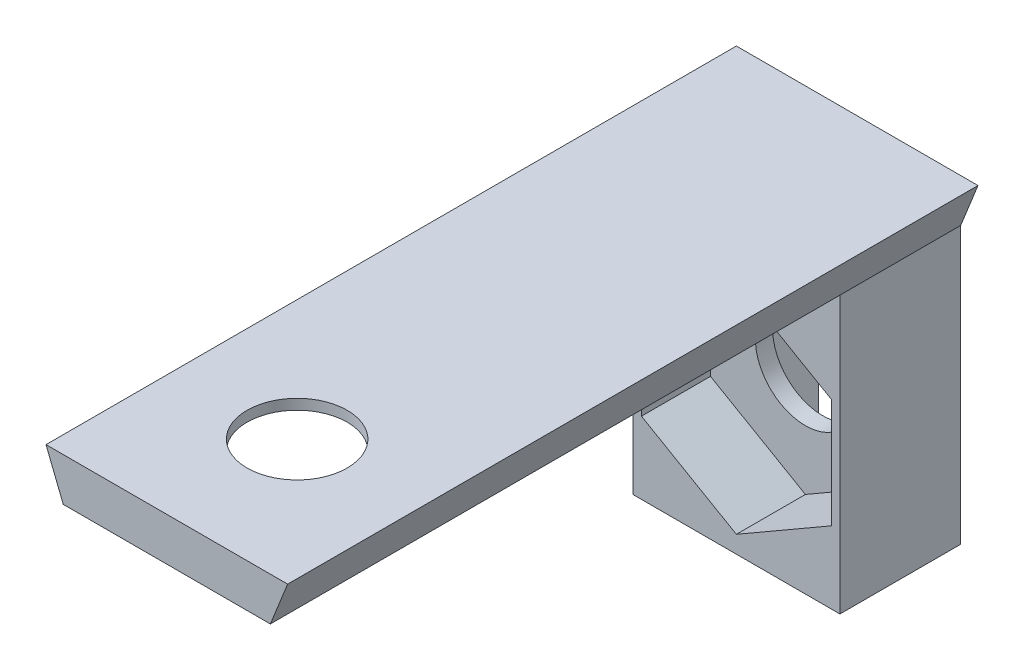
from build123d import *

# Parameters (mm, degrees)
SKETCH1_W           = 12
SKETCH1_H           = 7
BOSS_EXTRUDE1_DEPTH = 16
CUT_EXTRUDE1_DEPTH  = 20
CUT_EXTRUDE2_REACH  = 20.466
SKETCH3_R           = 2.9
CUT_EXTRUDE3_DEPTH  = 4
SKETCH5_W           = 14
SKETCH5_H           = 40
BOSS_EXTRUDE2_DEPTH = 2.5
CUT_EXTRUDE4_REACH  = 46.623
CUT_EXTRUDE6_DEPTH  = 1.9
CUT_EXTRUDE7_REACH  = 43.251
SKETCH9_R           = 2.9


with BuildPart() as part:
    # Sketch1 → Boss-Extrude1 (new body)
    with BuildSketch(Plane(origin=(0, 0, 0), x_dir=(1, 0, 0), z_dir=(0, 1, 0))):
        Rectangle(SKETCH1_W, SKETCH1_H)
    extrude(amount=BOSS_EXTRUDE1_DEPTH)

    # Sketch2 → Cut-Extrude1 (cut)
    with BuildSketch(Plane(origin=(0, 16, 0), x_dir=(1, 0, 0), z_dir=(0, 1, 0))):
        Polygon((0, 3.5), (2.25, 3.5), (4.25, 1.5), (0, 1.5), (-4.25, 1.5), (-2.25, 3.5), align=None)
    extrude(amount=-CUT_EXTRUDE1_DEPTH, mode=Mode.SUBTRACT)

    # Sketch3 → Cut-Extrude2 (cut, up to next)
    with BuildSketch(Plane.XY.offset(3.5), mode=Mode.PRIVATE) as cut_extrude2_sk1:
        with Locations((0, 7.35)):
            Circle(SKETCH3_R)
    cut_extrude2_tool1 = extrude(cut_extrude2_sk1.sketch, amount=-CUT_EXTRUDE2_REACH, mode=Mode.PRIVATE) & part.part
    add(cut_extrude2_tool1.solids().sort_by_distance((0, 7.35, 3.5))[0], mode=Mode.SUBTRACT)

    # Sketch4 → Cut-Extrude3 (cut)
    with BuildSketch(Plane.XY.offset(3.5)):
        Polygon((0, 13.700852961), (-5.5, 10.525426481), (-5.5, 4.174573519), (0, 0.999147039), (5.5, 4.174573519), (5.5, 10.525426481), align=None)
    extrude(amount=-CUT_EXTRUDE3_DEPTH, mode=Mode.SUBTRACT)

    # Sketch5 → Boss-Extrude2 (add)
    with BuildSketch(Plane(origin=(0, 16, 0), x_dir=(1, 0, 0), z_dir=(0, 1, 0))):
        with Locations((0, -16.5)):
            Rectangle(SKETCH5_W, SKETCH5_H)
    extrude(amount=BOSS_EXTRUDE2_DEPTH)

    # Sketch6 → Cut-Extrude4 (cut, up to next)
    with BuildSketch(Plane(origin=(0, 0, -3.5), x_dir=(-1, 0, 0), z_dir=(0, 0, -1)), mode=Mode.PRIVATE) as cut_extrude4_sk1:
        Polygon((-7, 16), (-7, 18.5), (-6, 16), align=None)
    cut_extrude4_tool1 = extrude(cut_extrude4_sk1.sketch, amount=-CUT_EXTRUDE4_REACH, mode=Mode.PRIVATE) & part.part
    # Sketch6 → Cut-Extrude4 (cut, up to next)
    with BuildSketch(Plane(origin=(0, 0, -3.5), x_dir=(-1, 0, 0), z_dir=(0, 0, -1)), mode=Mode.PRIVATE) as cut_extrude4_sk2:
        Polygon((7, 16), (6, 16), (7, 18.5), align=None)
    cut_extrude4_tool2 = extrude(cut_extrude4_sk2.sketch, amount=-CUT_EXTRUDE4_REACH, mode=Mode.PRIVATE) & part.part
    add(cut_extrude4_tool1.solids().sort_by_distance((6.666667, 16.833333, -3.5))[0], mode=Mode.SUBTRACT)
    add(cut_extrude4_tool2.solids().sort_by_distance((-6.666667, 16.833333, -3.5))[0], mode=Mode.SUBTRACT)

    # Sketch8 → Cut-Extrude6 (cut)
    with BuildSketch(Plane.XZ.offset(-16)):
        Polygon((0, 22.599147039), (5.5, 25.774573519), (5.5, 32.125426481), (0, 35.300852961), (-5.5, 32.125426481), (-5.5, 25.774573519), align=None)
    extrude(amount=-CUT_EXTRUDE6_DEPTH, mode=Mode.SUBTRACT)

    # Sketch9 → Cut-Extrude7 (cut, up to next)
    with BuildSketch(Plane(origin=(0, 17.9, 0), x_dir=(-1, 0, 0), z_dir=(0, -1, 0)), mode=Mode.PRIVATE) as cut_extrude7_sk1:
        with Locations(Location((0, -28.95, 0), (0, 0, 90))):
            Circle(SKETCH9_R)
    cut_extrude7_tool1 = extrude(cut_extrude7_sk1.sketch, amount=-CUT_EXTRUDE7_REACH, mode=Mode.PRIVATE) & part.part
    add(cut_extrude7_tool1.solids().sort_by_distance((0, 17.9, 28.95))[0], mode=Mode.SUBTRACT)


solid = part.part
